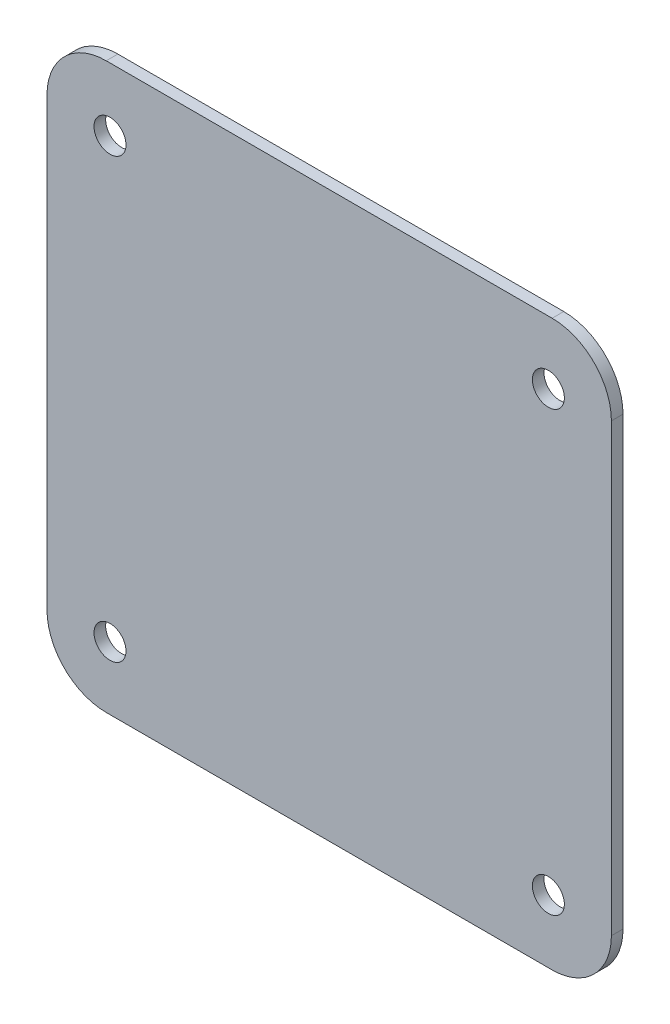
from build123d import *

# Parameters (mm, degrees)
SKETCH1_W               = 76.2
SKETCH1_H               = 76.2
BOSS_EXTRUDE1_DEPTH     = 1.57
CUT_EXTRUDE1_DEPTH      = 16
CUT_EXTRUDE1_DEPTH_BACK = 10.57
SKETCH1_4_R             = 2.159
CUT_EXTRUDE2_DEPTH      = 24
CUT_EXTRUDE2_DEPTH_BACK = 19.57
SKETCH1_5_R             = 2.159
FILLET1_R               = 8


with BuildPart() as part:
    # Sketch1 → Boss-Extrude1 (new body)
    with BuildSketch(Plane.XY):
        Rectangle(SKETCH1_W, SKETCH1_H)
    extrude(amount=BOSS_EXTRUDE1_DEPTH)

    # Sketch1<4> → Cut-Extrude1 (cut, two sides: drawn at the far end of the back side and taken through both)
    with BuildSketch(Plane.XY.offset(-CUT_EXTRUDE1_DEPTH_BACK)):
        with Locations((29.591, 29.591)):
            Circle(SKETCH1_4_R)
    extrude(amount=CUT_EXTRUDE1_DEPTH + CUT_EXTRUDE1_DEPTH_BACK, mode=Mode.SUBTRACT)

    # Sketch1<5> → Cut-Extrude2 (cut, two sides: drawn at the far end of the back side and taken through both)
    with BuildSketch(Plane.XY.offset(-CUT_EXTRUDE2_DEPTH_BACK)):
        with Locations((-29.591, 29.591)):
            Circle(SKETCH1_5_R)
        with Locations((-29.591, -29.591)):
            Circle(SKETCH1_5_R)
        with Locations((29.591, -29.591)):
            Circle(SKETCH1_5_R)
    extrude(amount=CUT_EXTRUDE2_DEPTH + CUT_EXTRUDE2_DEPTH_BACK, mode=Mode.SUBTRACT)

    # Fillet1
    fillet1_edges = [part.edges().sort_by_distance(p)[0] for p in [
        (-38.1, -38.1, 0.785),
        (38.1, -38.1, 0.785),
        (38.1, 38.1, 0.785),
        (-38.1, 38.1, 0.785),
    ]]
    fillet(fillet1_edges, radius=FILLET1_R)


solid = part.part
